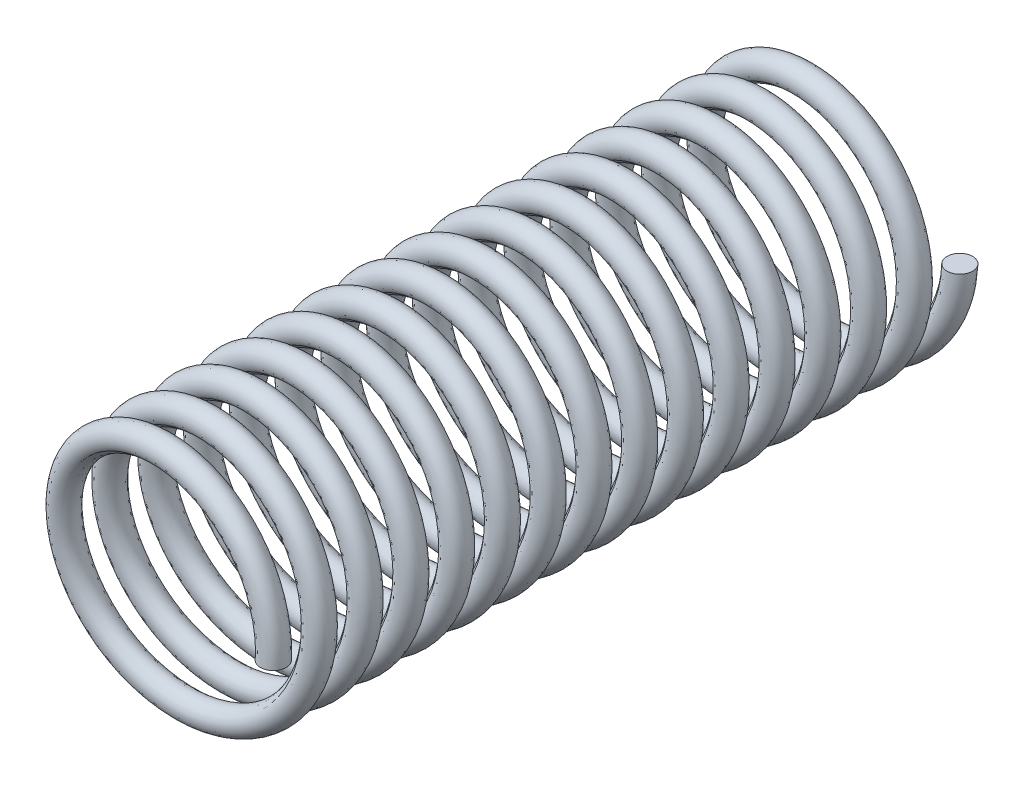
from build123d import *

# Parameters (mm, degrees)
SWEEP1_PITCH  = 1.27
SWEEP1_HEIGHT = 19.05
SWEEP1_RADIUS = 3.216275
SKETCH2_R     = 0.3556


with BuildPart() as part:
    # Sweep1: sweep along a helix
    with BuildLine() as sweep1_path:
        Helix(SWEEP1_PITCH, SWEEP1_HEIGHT, SWEEP1_RADIUS, center=(0, 0, 0), direction=(0, 0, 1), lefthand=True)
    # Sketch2 → Sweep1 (sweep)
    with BuildSketch(Plane(origin=(0, 0, 0), x_dir=(1, 0, 0), z_dir=(0, 1, 0))):
        with Locations((3.216275, 0)):
            Circle(SKETCH2_R)
    sweep(path=sweep1_path.line, is_frenet=True)


solid = part.part
